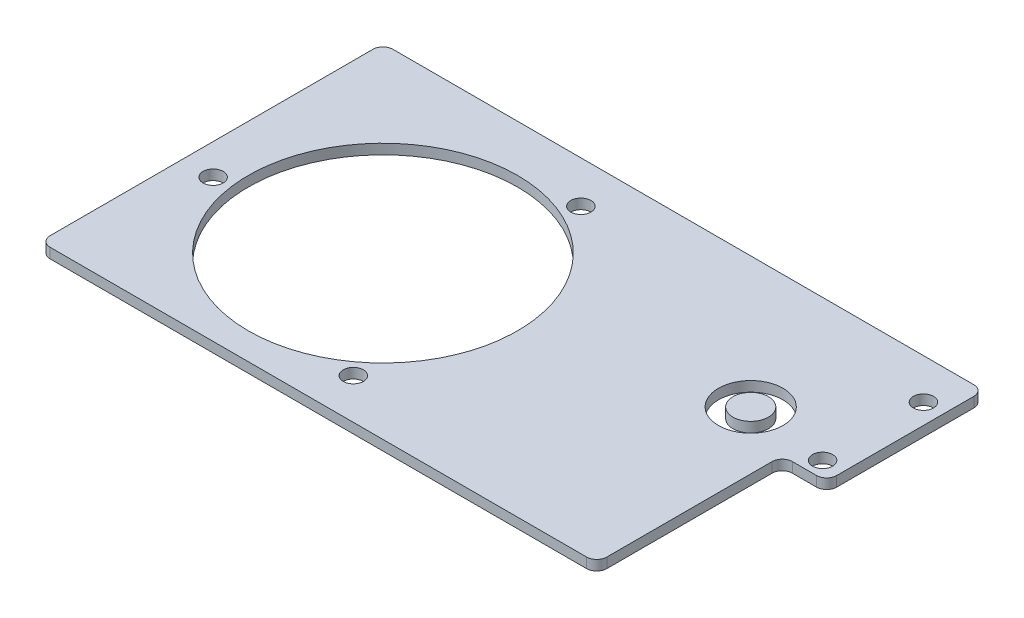
from build123d import *

# Parameters (mm, degrees)
SKETCH1_R           = 84.7725
SKETCH1_R_2         = 6.35
BOSS_EXTRUDE1_DEPTH = 6.35
SKETCH4_R           = 20.32
SKETCH4_R_2         = 11.176
CUT_EXTRUDE1_DEPTH  = 9.652


with BuildPart() as part:
    # Sketch1 → Boss-Extrude1 (new body)
    with BuildSketch(Plane(origin=(0, 0, 0), x_dir=(1, 0, 0), z_dir=(0, 1, 0))):
        with BuildLine():
            Line((257.81, 114.3), (-107.95, 114.3))
            ThreePointArc((-107.95, 114.3), (-112.440128061, 112.440128061), (-114.3, 107.95))
            Line((-114.3, 107.95), (-114.3, -95.25))
            ThreePointArc((-114.3, -95.25), (-112.440128061, -99.740128061), (-107.95, -101.6))
            Line((-107.95, -101.6), (229.87, -101.6))
            ThreePointArc((229.87, -101.6), (234.360128061, -99.740128061), (236.22, -95.25))
            Line((236.22, -95.25), (236.22, 8.89))
            ThreePointArc((236.22, 8.89), (238.079871939, 13.380128061), (242.57, 15.24))
            Line((242.57, 15.24), (257.81, 15.24))
            ThreePointArc((257.81, 15.24), (262.300128061, 17.099871939), (264.16, 21.59))
            Line((264.16, 21.59), (264.16, 107.95))
            ThreePointArc((264.16, 107.95), (262.300128061, 112.440128061), (257.81, 114.3))
        make_face()
        with Locations(Location((0, 0, 0), (0, 0, 270))):
            Circle(SKETCH1_R, mode=Mode.SUBTRACT)
        with Locations(Location((-94.868167084, -12.066247057, 0), (0, 0, 270))):
            Circle(SKETCH1_R_2, mode=Mode.SUBTRACT)
        with Locations(Location((36.791640664, 87.857485038, 0), (0, 0, 270))):
            Circle(SKETCH1_R_2, mode=Mode.SUBTRACT)
        with Locations(Location((57.498227226, -76.125119177, 0), (0, 0, 270))):
            Circle(SKETCH1_R_2, mode=Mode.SUBTRACT)
        with Locations(Location((251.46, 88.9, 0), (0, 0, 270))):
            Circle(SKETCH1_R_2, mode=Mode.SUBTRACT)
        with Locations(Location((251.46, 25.4, 0), (0, 0, 270))):
            Circle(SKETCH1_R_2, mode=Mode.SUBTRACT)
    extrude(amount=BOSS_EXTRUDE1_DEPTH)

    # Sketch4 → Cut-Extrude1 (cut)
    with BuildSketch(Plane(origin=(0, 6.35, 0), x_dir=(1, 0, 0), z_dir=(0, 1, 0))):
        with Locations(Location((199.663269189, 31.949583289, 0), (0, 0, 270))):
            Circle(SKETCH4_R)
        with Locations(Location((199.663269189, 31.949583289, 0), (0, 0, 270))):
            Circle(SKETCH4_R_2, mode=Mode.SUBTRACT)
    extrude(amount=-CUT_EXTRUDE1_DEPTH, mode=Mode.SUBTRACT)


with BuildPart() as cut_extrude1_piece_1:
    # of the separate pieces the step leaves, piece 1, a body of its own (cut_extrude1_pieces)
    add(part.part.solids().sort_by_distance((257.81, 0, -114.3))[0])


with BuildPart() as cut_extrude1_piece_2:
    # of the separate pieces the step leaves, piece 2, a body of its own (cut_extrude1_pieces)
    add(part.part.solids().sort_by_distance((199.663269189, 0, -20.773583289))[0])


solid = Compound([cut_extrude1_piece_1.part, cut_extrude1_piece_2.part])
